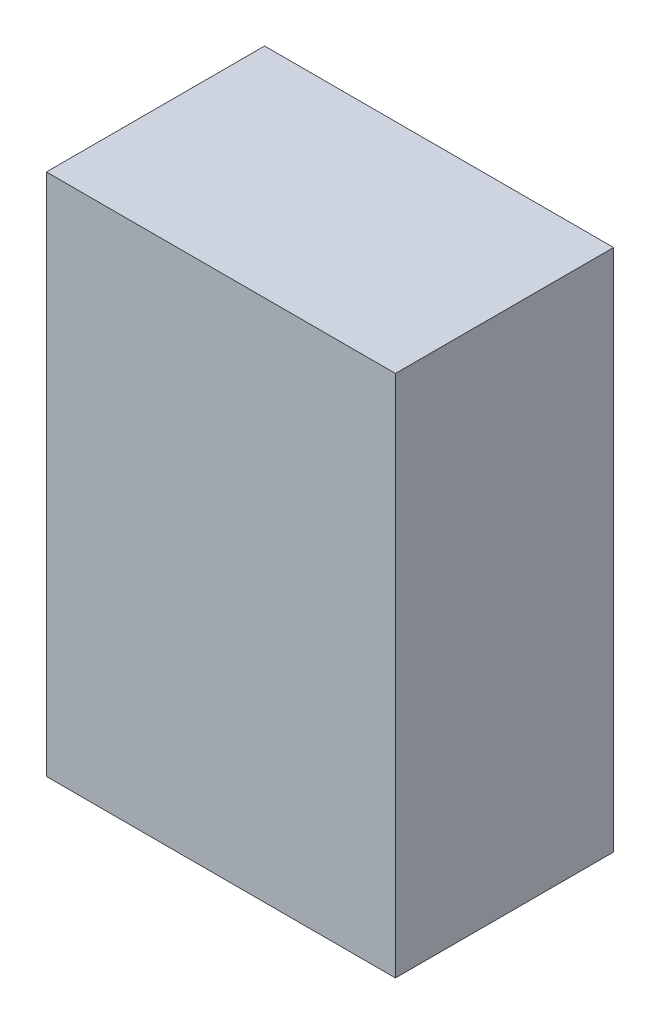
from build123d import *

# Parameters (mm, degrees)
SKETCH_1_W      = 80
SKETCH_1_H      = 50
EXTRUDE_1_DEPTH = 120


with BuildPart() as part:
    # 草图1 → 凸台-拉伸1 (new body)
    with BuildSketch(Plane(origin=(0, 0, 0), x_dir=(1, 0, 0), z_dir=(0, 1, 0))):
        Rectangle(SKETCH_1_W, SKETCH_1_H)
    extrude(amount=EXTRUDE_1_DEPTH)


solid = part.part
